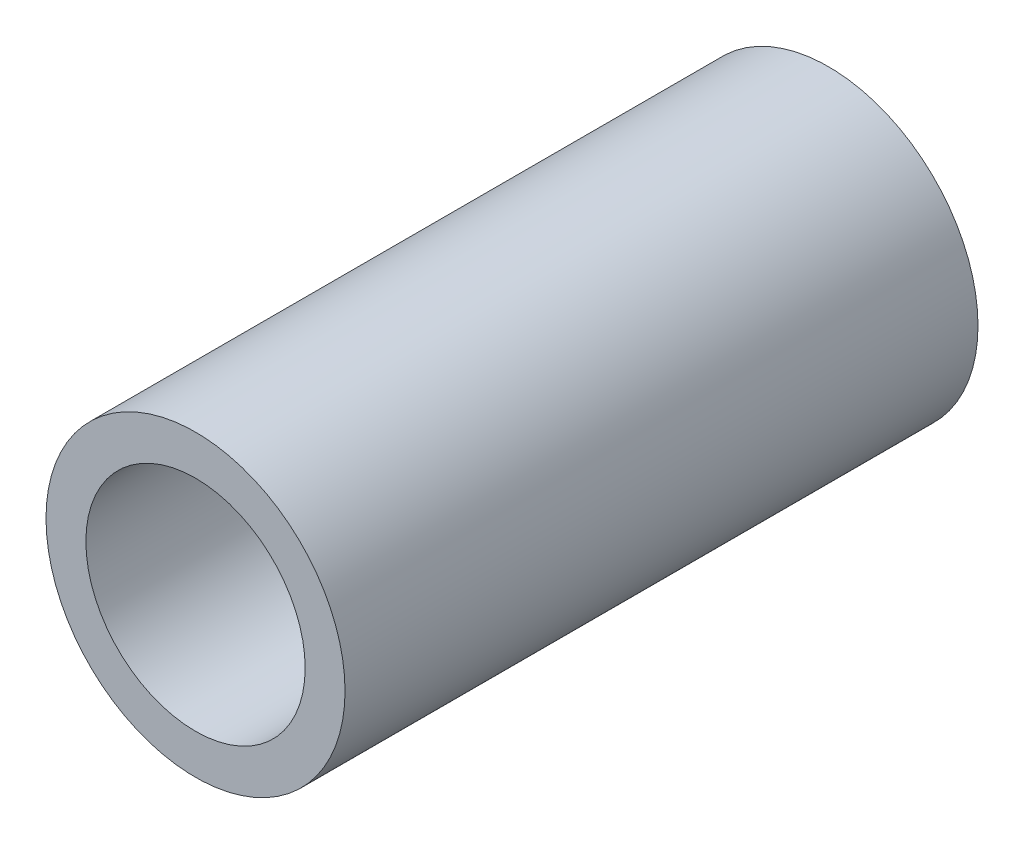
from build123d import *

# Parameters (mm, degrees)
SKETCH1_R           = 1.5
BOSS_EXTRUDE1_DEPTH = 6.35
SKETCH2_R           = 1.1
CUT_EXTRUDE1_DEPTH  = 7.694960792


with BuildPart() as part:
    # Sketch1 → Boss-Extrude1 (new body)
    with BuildSketch(Plane.XY):
        Circle(SKETCH1_R)
    extrude(amount=BOSS_EXTRUDE1_DEPTH)

    # Sketch2 → Cut-Extrude1 (cut, through all)
    with BuildSketch(Plane(origin=(0, 0, 0), x_dir=(-1, 0, 0), z_dir=(0, 0, -1))):
        Circle(SKETCH2_R)
    extrude(amount=-CUT_EXTRUDE1_DEPTH, mode=Mode.SUBTRACT)


solid = part.part
